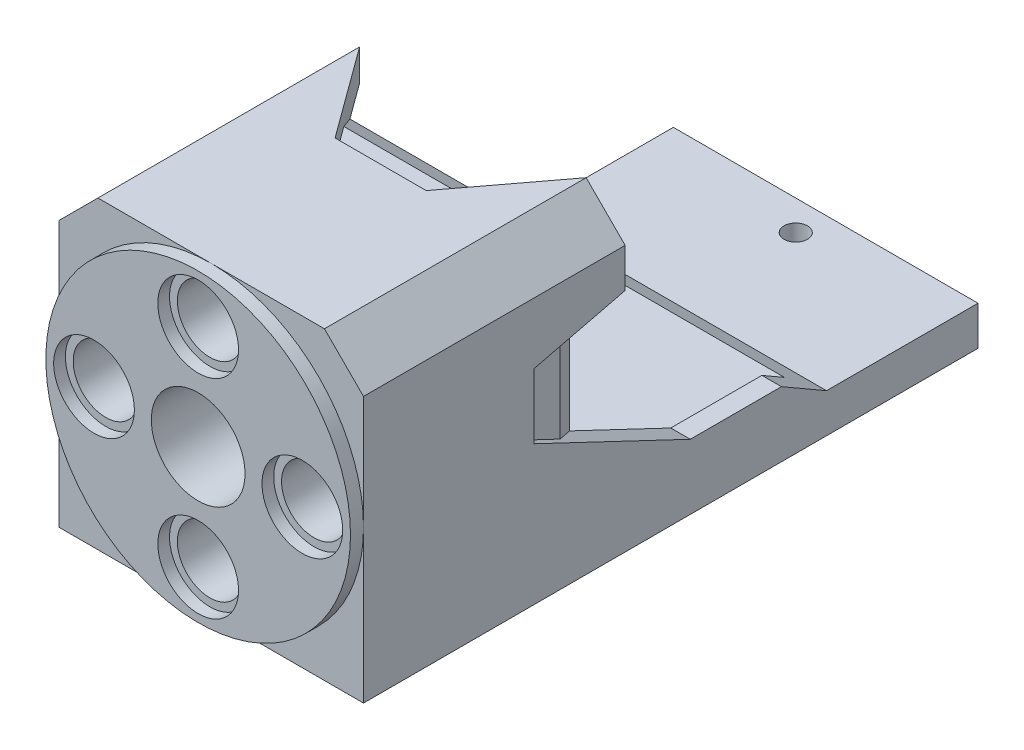
from build123d import *

# Parameters (mm, degrees)
SKETCH_1_R                  = 11.7
EXTRUDE_1_DEPTH             = 7.7
SKETCH_1_3_R                = 2.5
CUT_EXTRUDE_1_DEPTH         = 19.250205478
SKETCH_1_5_R                = 3.1
SKETCH_1_5_R_2              = 2.5
CUT_EXTRUDE_2_DEPTH         = 0.9
CUT_EXTRUDE_START           = -6.8
SKETCH_1_6_R                = 3.1
SKETCH_1_6_R_2              = 2.5
CUT_EXTRUDE_3_DEPTH         = 0.9
EXTRUDE_START               = -7.7
SKETCH_2_W                  = 23.4
SKETCH_2_H                  = 2.4
SKETCH_2_H_2                = 4
EXTRUDE_3_DEPTH             = 40.5
SKETCH_3_W                  = 1.5
SKETCH_3_H                  = 23.4
EXTRUDE_4_DEPTH             = 40.3
EXTRUDE_START_2             = -1
EXTRUDE_5_DEPTH             = 6.7
CUT_EXTRUDE_5_DEPTH         = 55.842410596
CHAMFER_1_SIZE              = 3
CUT_EXTRUDE_6_REACH         = 56.842
EXTRUDE_6_REACH             = 52.961
EXTRUDE_6_DIRECTION_2_REACH = 52.961
EXTRUDE_7_REACH             = 52.961
EXTRUDE_7_DIRECTION_2_REACH = 52.961
HOLE_WIZARD_1_D             = 1.8
HOLE_WIZARD_1_CBORE_D       = 3.67
HOLE_WIZARD_1_CBORE_DEPTH   = 1.35
CUT_EXTRUDE_7_REACH         = 52.961
SKETCH_19_R                 = 3.6


with BuildPart() as part:
    # 草图1 → 凸台-拉伸1 (new body)
    with BuildSketch(Plane.XY):
        Circle(SKETCH_1_R)
    extrude(amount=-EXTRUDE_1_DEPTH)

    # 草图1<3> → 切除-拉伸1 (cut, through all)
    with BuildSketch(Plane.XY):
        with Locations((-8, 0)):
            Circle(SKETCH_1_3_R)
        with Locations((0, 8)):
            Circle(SKETCH_1_3_R)
        with Locations((8, 0)):
            Circle(SKETCH_1_3_R)
        with Locations((0, -8)):
            Circle(SKETCH_1_3_R)
    extrude(amount=-CUT_EXTRUDE_1_DEPTH, mode=Mode.SUBTRACT)

    # 草图1<5> → 切除-拉伸2 (cut)
    # profile 1 of 4: a face of its own
    with BuildSketch(Plane.XY):
        with Locations((-8, 0)):
            Circle(SKETCH_1_5_R)
        with Locations((-8, 0)):
            Circle(SKETCH_1_5_R_2, mode=Mode.SUBTRACT)
    # profile 2 of 4: a face of its own
    with BuildSketch(Plane.XY):
        with Locations((0, 8)):
            Circle(SKETCH_1_5_R)
        with Locations((0, 8)):
            Circle(SKETCH_1_5_R_2, mode=Mode.SUBTRACT)
    # profile 3 of 4: a face of its own
    with BuildSketch(Plane.XY):
        with Locations((8, 0)):
            Circle(SKETCH_1_5_R)
        with Locations((8, 0)):
            Circle(SKETCH_1_5_R_2, mode=Mode.SUBTRACT)
    # profile 4 of 4: a face of its own
    with BuildSketch(Plane.XY):
        with Locations((0, -8)):
            Circle(SKETCH_1_5_R)
        with Locations((0, -8)):
            Circle(SKETCH_1_5_R_2, mode=Mode.SUBTRACT)
    extrude(amount=-CUT_EXTRUDE_2_DEPTH, mode=Mode.SUBTRACT)

    # 草图1<6> → 切除-拉伸3 (cut)
    # profile 1 of 4: a face of its own
    with BuildSketch(Plane.XY.offset(CUT_EXTRUDE_START)):
        with Locations((-8, 0)):
            Circle(SKETCH_1_6_R)
        with Locations((-8, 0)):
            Circle(SKETCH_1_6_R_2, mode=Mode.SUBTRACT)
    # profile 2 of 4: a face of its own
    with BuildSketch(Plane.XY.offset(CUT_EXTRUDE_START)):
        with Locations((8, 0)):
            Circle(SKETCH_1_6_R)
        with Locations((8, 0)):
            Circle(SKETCH_1_6_R_2, mode=Mode.SUBTRACT)
    # profile 3 of 4: a face of its own
    with BuildSketch(Plane.XY.offset(CUT_EXTRUDE_START)):
        with Locations((0, -8)):
            Circle(SKETCH_1_6_R)
        with Locations((0, -8)):
            Circle(SKETCH_1_6_R_2, mode=Mode.SUBTRACT)
    # profile 4 of 4: a face of its own
    with BuildSketch(Plane.XY.offset(CUT_EXTRUDE_START)):
        with Locations((0, 8)):
            Circle(SKETCH_1_6_R)
        with Locations((0, 8)):
            Circle(SKETCH_1_6_R_2, mode=Mode.SUBTRACT)
    extrude(amount=-CUT_EXTRUDE_3_DEPTH, mode=Mode.SUBTRACT)

    # 草图2 → 凸台-拉伸3 (add)
    with BuildSketch(Plane.XY.offset(EXTRUDE_START)):
        with Locations((0, 10.5)):
            Rectangle(SKETCH_2_W, SKETCH_2_H)
        with Locations((0, -9.7)):
            Rectangle(SKETCH_2_W, SKETCH_2_H_2)
    extrude(amount=-EXTRUDE_3_DEPTH)

    # 草图3 → 凸台-拉伸4 (add)
    with BuildSketch(Plane.XY.offset(EXTRUDE_START)):
        with Locations((-10.95, 0)):
            Rectangle(SKETCH_3_W, SKETCH_3_H)
        with Locations((10.95, 0)):
            Rectangle(SKETCH_3_W, SKETCH_3_H)
    extrude(amount=-EXTRUDE_4_DEPTH)

    # 草图4 → 凸台-拉伸5 (add)
    with BuildSketch(Plane.XY.offset(EXTRUDE_START_2)):
        with BuildLine():
            Line((3.2e-08, 11.7), (-11.7, 11.7))
            Line((-11.7, 11.7), (-11.7, 0))
            ThreePointArc((-11.7, 0), (-8.273149328, 8.273149351), (3.2e-08, 11.7))
        make_face()
        with BuildLine():
            Line((11.7, 11.7), (3.2e-08, 11.7))
            ThreePointArc((3.2e-08, 11.7), (8.273149351, 8.273149328), (11.7, 0))
            Line((11.7, 0), (11.7, 11.7))
        make_face()
        with BuildLine():
            ThreePointArc((3e-09, -11.7), (-8.273149339, -8.273149341), (-11.7, 0))
            Line((-11.7, 0), (-11.7, -11.7))
            Line((-11.7, -11.7), (3e-09, -11.7))
        make_face()
        with BuildLine():
            Line((11.7, -11.7), (11.7, 0))
            ThreePointArc((11.7, 0), (8.273149341, -8.273149339), (3e-09, -11.7))
            Line((3e-09, -11.7), (11.7, -11.7))
        make_face()
    extrude(amount=-EXTRUDE_5_DEPTH)

    # 草图7 → 切除-拉伸5 (cut, through all)
    with BuildSketch(Plane.ZY.offset(11.7)):
        Polygon((-48.2, 11.7), (-48.2, -8.7), (-36.564101615, -8.7), (-33.1, -6.7), (-26.1, -6.7), (-14.1, -1), (-14.1, 4), (-21.1, 5.7), (-21.1, 11.7), align=None)
    extrude(amount=-CUT_EXTRUDE_5_DEPTH, mode=Mode.SUBTRACT)

    # 倒角1
    chamfer_1_edges = [part.edges().sort_by_distance(p)[0] for p in [
        (-11.7, 11.7, -11.05),
        (11.7, 11.7, -11.05),
    ]]
    chamfer(chamfer_1_edges, length=CHAMFER_1_SIZE)

    # 草图8 → 切除-拉伸6 (cut, up to next)
    with BuildSketch(Plane(origin=(0, 11.7, 0), x_dir=(1, 0, 0), z_dir=(0, 1, 0)), mode=Mode.PRIVATE) as cut_extrude_6_sk1:
        Polygon((8.7, 21.1), (3.414837489, 14.1), (-3.585162511, 14.1), (-8.7, 21.1), align=None)
    cut_extrude_6_tool1 = extrude(cut_extrude_6_sk1.sketch, amount=-CUT_EXTRUDE_6_REACH, mode=Mode.PRIVATE) & part.part
    add(cut_extrude_6_tool1.solids().sort_by_distance((-0.036531, 11.7, -18.097268))[0], mode=Mode.SUBTRACT)

    # 草图12 → 凸台-拉伸6 (add, up to next)
    with BuildSketch(Plane(origin=(0, 0, 0), x_dir=(0, 0, -1), z_dir=(1, 0, 0)), mode=Mode.PRIVATE) as extrude_6_sk1:
        Polygon((14.1, 10.3), (16.6, 10.3), (18.332050808, 9.3), (14.1, 9.3), align=None)
    extrude_6_tool1 = extrude(extrude_6_sk1.sketch, amount=EXTRUDE_6_REACH, mode=Mode.PRIVATE) - part.part
    add(extrude_6_tool1.solids().sort_by_distance((0, 9.757119, -15.820148))[0])

    # 草图12 → 凸台-拉伸6 direction 2 (add, up to next)
    with BuildSketch(Plane(origin=(0, 0, 0), x_dir=(0, 0, -1), z_dir=(1, 0, 0)), mode=Mode.PRIVATE) as extrude_6_direction_2_sk1:
        Polygon((14.1, 10.3), (16.6, 10.3), (18.332050808, 9.3), (14.1, 9.3), align=None)
    extrude_6_direction_2_tool1 = extrude(extrude_6_direction_2_sk1.sketch, amount=-EXTRUDE_6_DIRECTION_2_REACH, mode=Mode.PRIVATE) - part.part
    add(extrude_6_direction_2_tool1.solids().sort_by_distance((0, 9.757119, -15.820148))[0])

    # 草图13 → 凸台-拉伸7 (add, up to next)
    with BuildSketch(Plane(origin=(0, 0, 0), x_dir=(1, 0, 0), z_dir=(0, 1, 0)), mode=Mode.PRIVATE) as extrude_7_sk1:
        Polygon((10.2, 14.1), (11.2, 14.1), (11.2, 16.6), (10.2, 18.332050808), align=None)
    extrude_7_tool1 = extrude(extrude_7_sk1.sketch, amount=EXTRUDE_7_REACH, mode=Mode.PRIVATE) - part.part
    # 草图13 → 凸台-拉伸7 (add, up to next)
    with BuildSketch(Plane(origin=(0, 0, 0), x_dir=(1, 0, 0), z_dir=(0, 1, 0)), mode=Mode.PRIVATE) as extrude_7_sk2:
        Polygon((-10.2, 14.1), (-11.2, 14.1), (-11.2, 16.6), (-10.2, 18.332050808), align=None)
    extrude_7_tool2 = extrude(extrude_7_sk2.sketch, amount=EXTRUDE_7_REACH, mode=Mode.PRIVATE) - part.part
    add(extrude_7_tool1.solids().sort_by_distance((10.657119, 0, -15.820148))[0])
    add(extrude_7_tool2.solids().sort_by_distance((-10.657119, 0, -15.820148))[0])

    # 草图13 → 凸台-拉伸7 direction 2 (add, up to next)
    with BuildSketch(Plane(origin=(0, 0, 0), x_dir=(1, 0, 0), z_dir=(0, 1, 0)), mode=Mode.PRIVATE) as extrude_7_direction_2_sk1:
        Polygon((10.2, 14.1), (11.2, 14.1), (11.2, 16.6), (10.2, 18.332050808), align=None)
    extrude_7_direction_2_tool1 = extrude(extrude_7_direction_2_sk1.sketch, amount=-EXTRUDE_7_DIRECTION_2_REACH, mode=Mode.PRIVATE) - part.part
    # 草图13 → 凸台-拉伸7 direction 2 (add, up to next)
    with BuildSketch(Plane(origin=(0, 0, 0), x_dir=(1, 0, 0), z_dir=(0, 1, 0)), mode=Mode.PRIVATE) as extrude_7_direction_2_sk2:
        Polygon((-10.2, 14.1), (-11.2, 14.1), (-11.2, 16.6), (-10.2, 18.332050808), align=None)
    extrude_7_direction_2_tool2 = extrude(extrude_7_direction_2_sk2.sketch, amount=-EXTRUDE_7_DIRECTION_2_REACH, mode=Mode.PRIVATE) - part.part
    add(extrude_7_direction_2_tool1.solids().sort_by_distance((10.657119, 0, -15.820148))[0])
    add(extrude_7_direction_2_tool2.solids().sort_by_distance((-10.657119, 0, -15.820148))[0])

    # 孔1 (through all)
    with Locations(Plane(origin=(0, -11.7, -45.9), x_dir=(0, 0, -1), z_dir=(0, -1, 0))):
        with Locations((0, 0)):
            CounterBoreHole(HOLE_WIZARD_1_D / 2, HOLE_WIZARD_1_CBORE_D / 2, HOLE_WIZARD_1_CBORE_DEPTH)

    # 草图19 → 切除-拉伸7 (cut, up to next)
    with BuildSketch(Plane.XY, mode=Mode.PRIVATE) as cut_extrude_7_sk1:
        Circle(SKETCH_19_R)
    cut_extrude_7_tool1 = extrude(cut_extrude_7_sk1.sketch, amount=-CUT_EXTRUDE_7_REACH, mode=Mode.PRIVATE) & part.part
    add(cut_extrude_7_tool1.solids().sort_by_distance((0, 0, 0))[0], mode=Mode.SUBTRACT)


solid = part.part
